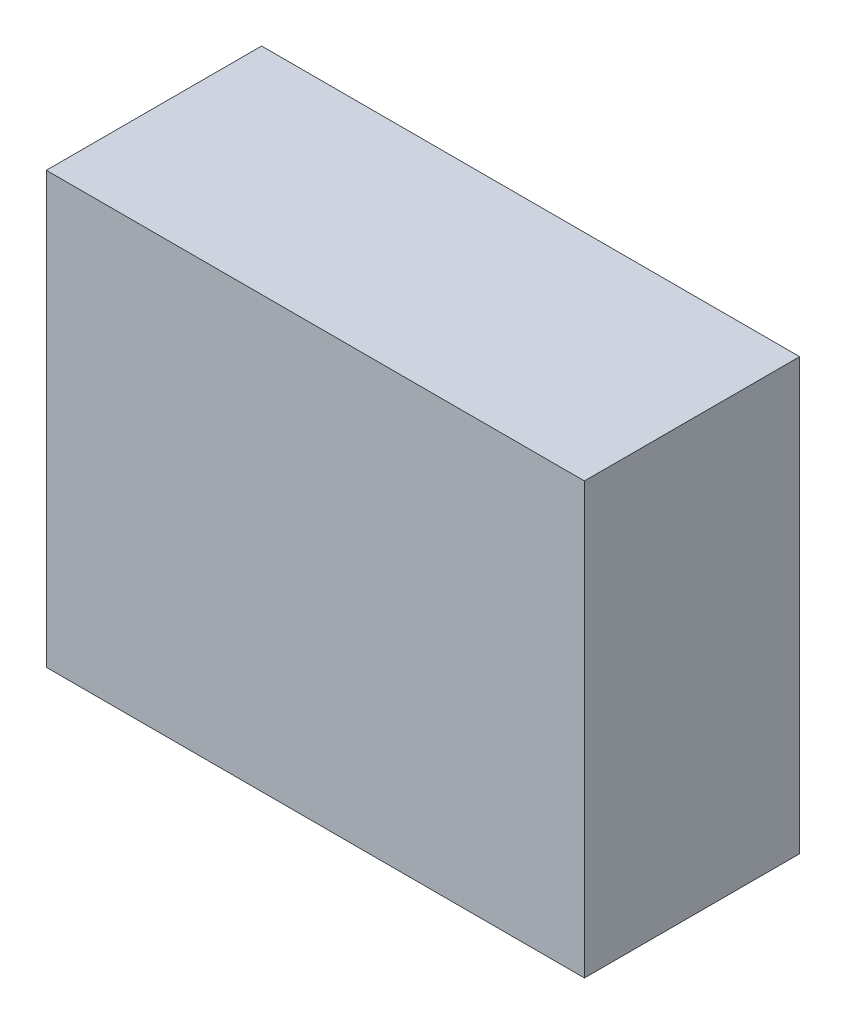
from build123d import *

# Parameters (mm, degrees)
SKETCH_1_W      = 50
SKETCH_1_H      = 20
EXTRUDE_1_DEPTH = 40


with BuildPart() as part:
    # 스케치1 → 보스-돌출1 (new body)
    with BuildSketch(Plane(origin=(0, 0, 0), x_dir=(1, 0, 0), z_dir=(0, 1, 0))):
        Rectangle(SKETCH_1_W, SKETCH_1_H)
    extrude(amount=EXTRUDE_1_DEPTH)


solid = part.part
